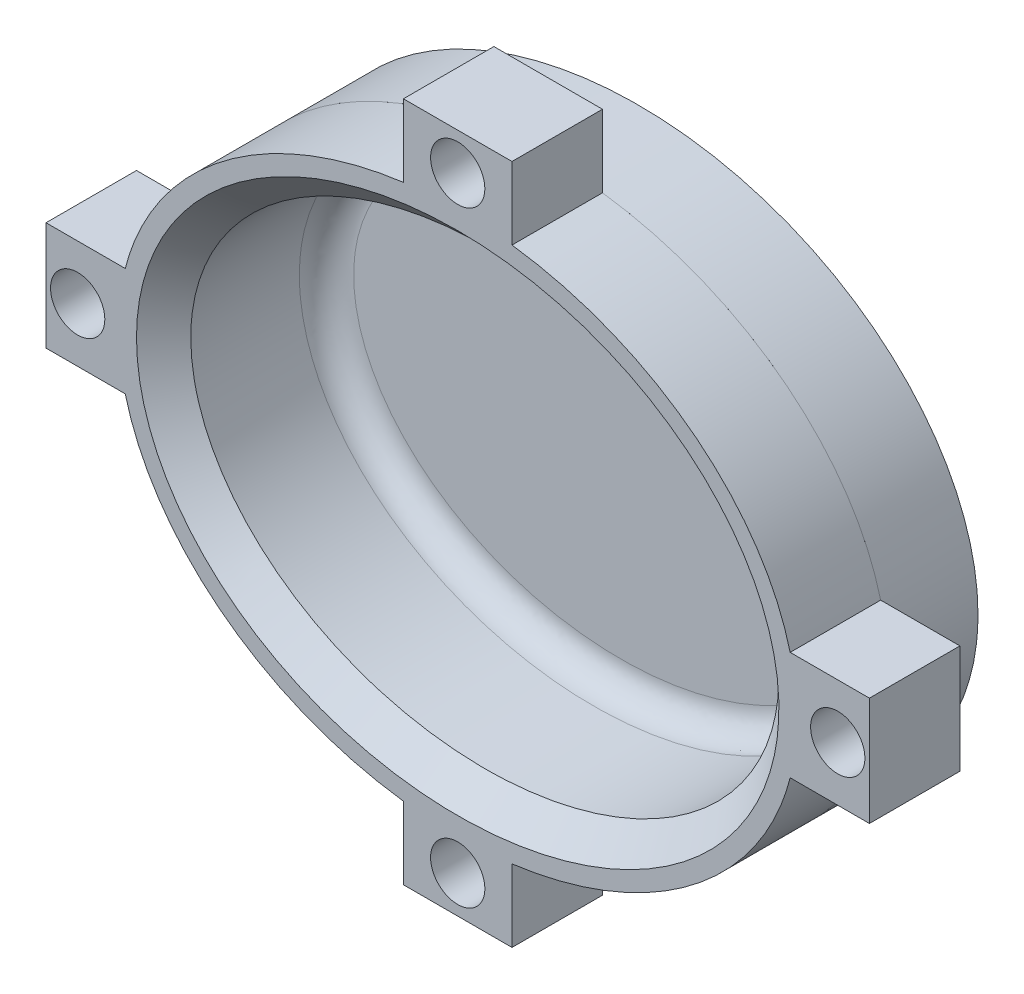
from build123d import *

# Parameters (mm, degrees)
SKETCH1_R           = 3
BOSS_EXTRUDE1_DEPTH = 10
SKETCH2_RX          = 37.5
SKETCH2_RY          = 30.000521952
BOSS_EXTRUDE2_DEPTH = 10
SKETCH3_RX          = 32.5
SKETCH3_RY          = 25
CUT_EXTRUDE1_DEPTH  = 18
FILLET1_R           = 3
CHAMFER1_SIZE       = 3


with BuildPart() as part:
    # Sketch1 → Boss-Extrude1 (new body)
    with BuildSketch(Plane.XY):
        with BuildLine():
            Line((-6, 29.61351043), (-6, 37.61351043))
            Line((-6, 37.61351043), (0, 37.61351043))
            Line((0, 37.61351043), (6, 37.61351043))
            Line((6, 37.61351043), (6, 29.61351043))
            add(Edge.make_bspline(
                [(36.742346142, 6), (31.563017437, 26.298740059), (6, 29.61351043)],
                knots=[3.342950574, 3.342950574, 3.342950574, 4.551698327, 4.551698327, 4.551698327], degree=2, weights=[1, 0.822858052, 1]))
            Line((36.742346142, 6), (45.5, 6))
            Line((45.5, 6), (45.5, -6))
            Line((45.5, -6), (36.742346142, -6))
            add(Edge.make_bspline(
                [(6, -29.61351043), (31.563017437, -26.298740059), (36.742346142, -6)],
                knots=[1.73148698, 1.73148698, 1.73148698, 2.940234733, 2.940234733, 2.940234733], degree=2, weights=[1, 0.822858052, 1]))
            Line((6, -29.61351043), (6, -37.61351043))
            Line((6, -37.61351043), (0, -37.61351043))
            Line((0, -37.61351043), (-6, -37.61351043))
            Line((-6, -37.61351043), (-6, -29.61351043))
            add(Edge.make_bspline(
                [(-36.742346142, -6), (-31.563017437, -26.298740059), (-6, -29.61351043)],
                knots=[0.201357921, 0.201357921, 0.201357921, 1.410105674, 1.410105674, 1.410105674], degree=2, weights=[1, 0.822858052, 1]))
            Line((-36.742346142, -6), (-45.5, -6))
            Line((-45.5, -6), (-45.5, 6))
            Line((-45.5, 6), (-36.742346142, 6))
            add(Edge.make_bspline(
                [(-6, 29.61351043), (-31.563017437, 26.298740059), (-36.742346142, 6)],
                knots=[4.873079633, 4.873079633, 4.873079633, 6.081827386, 6.081827386, 6.081827386], degree=2, weights=[1, 0.822858052, 1]))
        make_face()
        with Locations((0, 33.5)):
            Circle(SKETCH1_R, mode=Mode.SUBTRACT)
        with Locations(Location((0, -33.5, 0), (0, 0, 180))):
            Circle(SKETCH1_R, mode=Mode.SUBTRACT)
        with Locations((-42, 0)):
            Circle(SKETCH1_R, mode=Mode.SUBTRACT)
        with Locations(Location((42, 0, 0), (0, 0, 180))):
            Circle(SKETCH1_R, mode=Mode.SUBTRACT)
    extrude(amount=BOSS_EXTRUDE1_DEPTH)

    # Sketch2 → Boss-Extrude2 (add)
    with BuildSketch(Plane.XY):
        with Locations((0, 0)):
            Ellipse(SKETCH2_RX, SKETCH2_RY)
    extrude(amount=-BOSS_EXTRUDE2_DEPTH)

    # Sketch3 → Cut-Extrude1 (cut)
    with BuildSketch(Plane.XY.offset(10)):
        with Locations(Location((0, 0), (0, 0, 180))):
            Ellipse(SKETCH3_RX, SKETCH3_RY)
    extrude(amount=-CUT_EXTRUDE1_DEPTH, mode=Mode.SUBTRACT)

    # Fillet1
    fillet1_edges = [part.edges().sort_by_distance(p)[0] for p in [
        (32.499998894, 0.006523295, -8),
    ]]
    fillet(fillet1_edges, radius=FILLET1_R)

    # Chamfer1
    chamfer1_edges = [part.edges().sort_by_distance(p)[0] for p in [
        (32.499998894, 0.006523295, 10),
    ]]
    chamfer(chamfer1_edges, length=CHAMFER1_SIZE)


solid = part.part
